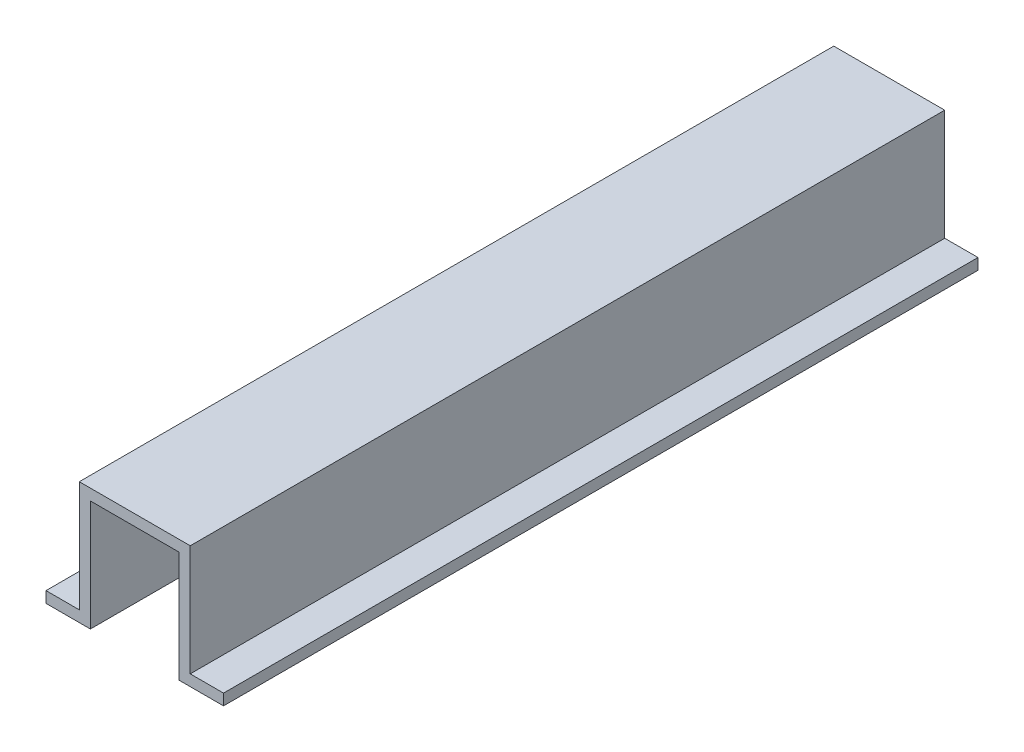
from build123d import *

# Parameters (mm, degrees)
F_10_MM_DEEP_HAT_SECTION_DEPTH = 68


with BuildPart() as part:
    # 10 mm deep hat section profile → 10 mm deep hat section (new body)
    with BuildSketch(Plane.XY):
        Polygon((-8, 7), (-4, 7), (-4, 17), (4, 17), (4, 7), (8, 7), (8, 8), (5, 8), (5, 18), (-5, 18), (-5, 8), (-8, 8), align=None)
    extrude(amount=F_10_MM_DEEP_HAT_SECTION_DEPTH)


solid = part.part
